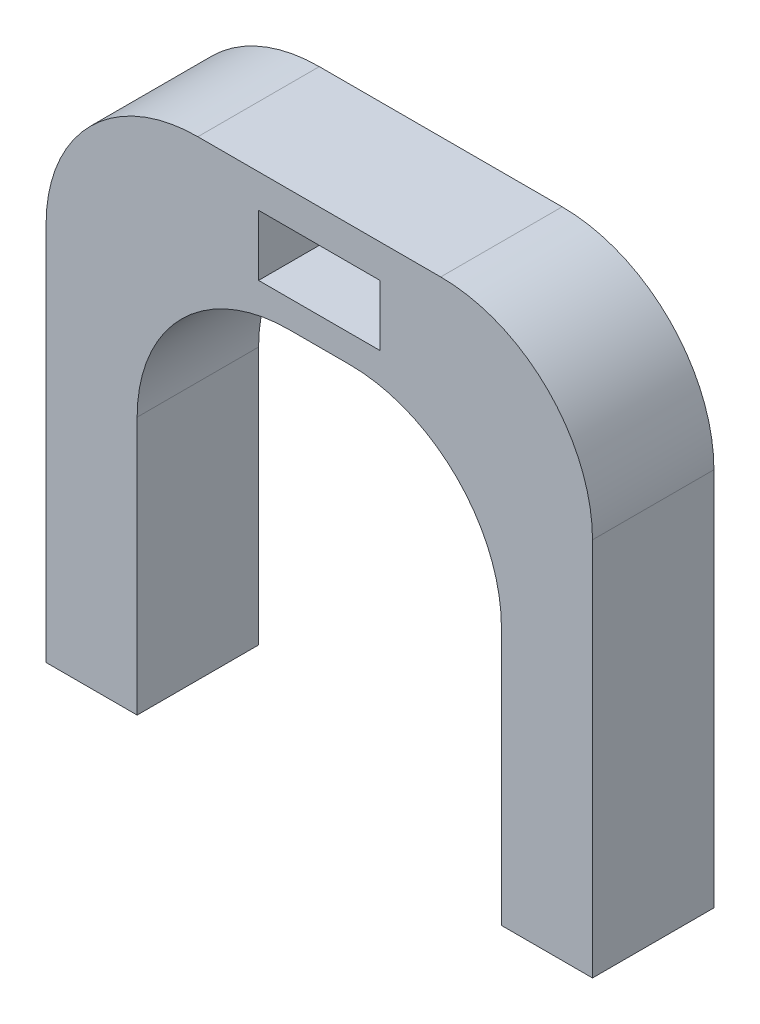
from build123d import *

# Parameters (mm, degrees)
SKETCH_2_W          = 18
SKETCH_2_H          = 21.5
EXTRUDE_1_DEPTH     = 4
SKETCH_3_W          = 12
SKETCH_3_H          = 17.5
CUT_EXTRUDE_1_DEPTH = 29.324018077
FILLET_1_R          = 5
FILLET_2_R          = 5
SKETCH_4_W          = 4
SKETCH_4_H          = 2
CUT_EXTRUDE_2_DEPTH = 29.324018077
SKETCH_8_W          = 3
SKETCH_8_H          = 4
CUT_EXTRUDE_5_DEPTH = 29.324018077


with BuildPart() as part:
    # ｽｹｯﾁ2 → ﾎﾞｽ - 押し出し1 (new body)
    with BuildSketch(Plane.XY):
        with Locations((9, 10.75)):
            Rectangle(SKETCH_2_W, SKETCH_2_H)
    extrude(amount=EXTRUDE_1_DEPTH)

    # ｽｹｯﾁ3 → ｶｯﾄ - 押し出し1 (cut, through all)
    with BuildSketch(Plane.XY.offset(4)):
        with Locations((9, 8.75)):
            Rectangle(SKETCH_3_W, SKETCH_3_H)
    extrude(amount=-CUT_EXTRUDE_1_DEPTH, mode=Mode.SUBTRACT)

    # ﾌｨﾚｯﾄ1
    fillet_1_edges = [part.edges().sort_by_distance(p)[0] for p in [
        (3, 17.5, 2),
        (15, 17.5, 2),
    ]]
    fillet(fillet_1_edges, radius=FILLET_1_R)

    # ﾌｨﾚｯﾄ2
    fillet_2_edges = [part.edges().sort_by_distance(p)[0] for p in [
        (0, 21.5, 2),
        (18, 21.5, 2),
    ]]
    fillet(fillet_2_edges, radius=FILLET_2_R)

    # ｽｹｯﾁ4 → ｶｯﾄ - 押し出し2 (cut, through all)
    with BuildSketch(Plane.XY.offset(4)):
        with Locations((9, 19.400947982)):
            Rectangle(SKETCH_4_W, SKETCH_4_H)
    extrude(amount=-CUT_EXTRUDE_2_DEPTH, mode=Mode.SUBTRACT)

    # ｽｹｯﾁ8 → ｶｯﾄ - 押し出し5 (cut, through all)
    with BuildSketch(Plane.XY.offset(4)):
        with Locations((1.5, 2)):
            Rectangle(SKETCH_8_W, SKETCH_8_H)
        with Locations((16.5, 2)):
            Rectangle(SKETCH_8_W, SKETCH_8_H)
    extrude(amount=-CUT_EXTRUDE_5_DEPTH, mode=Mode.SUBTRACT)


solid = part.part
